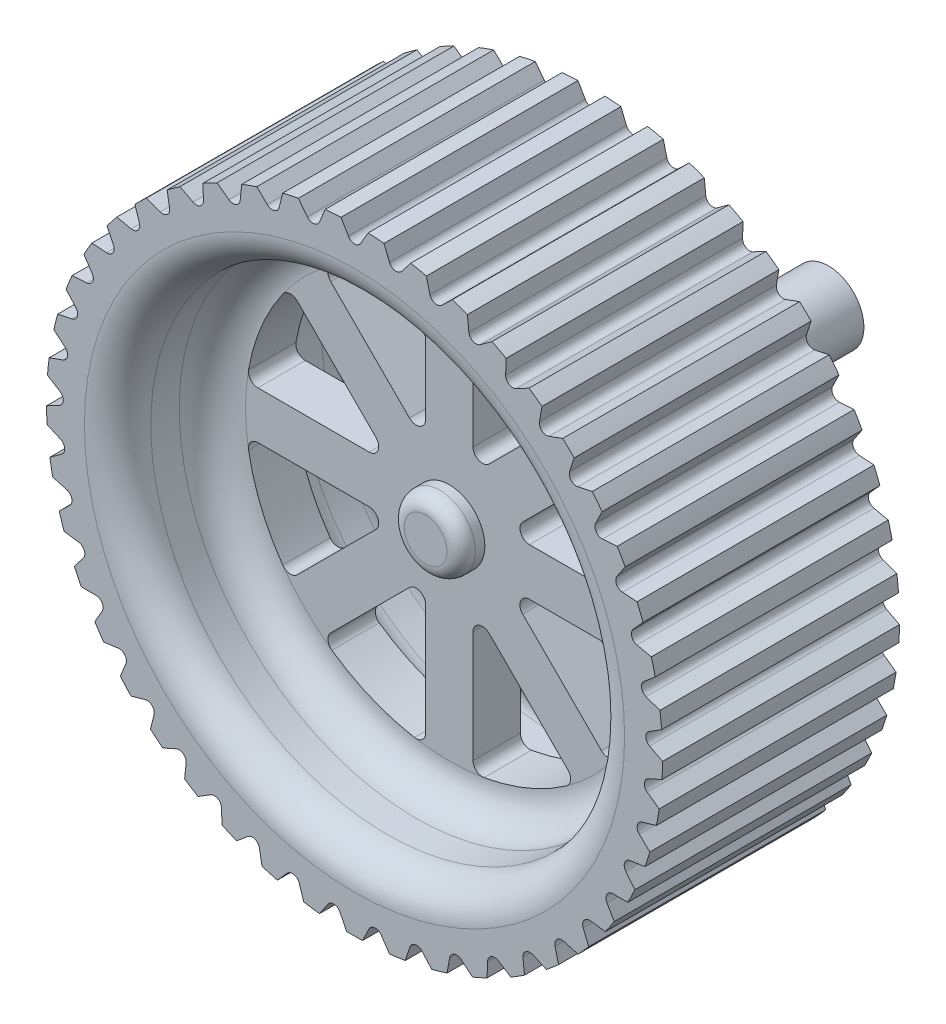
from build123d import *

# Parameters (mm, degrees)
SKETCH1_R                = 7.5
BOSS_EXTRUDE1_DEPTH      = 50
SKETCH2_R                = 65
BOSS_EXTRUDE2_DEPTH      = 50
CUT_EXTRUDE1_REACH       = 137.831
FILLET1_R                = 1.5
CIRPATTERN1_COUNT        = 45
FILLET1_OF_CIRPATTERN1_R = 1.5
SKETCH5_R                = 50
CUT_EXTRUDE2_DEPTH       = 20
CUT_EXTRUDE6_START       = -20
SKETCH6_R                = 50
SKETCH6_R_2              = 7.5
CUT_EXTRUDE6_DEPTH       = 20
FILLET2_R                = 7
BOSS_EXTRUDE3_START      = 5
SKETCH7_R                = 7.5
BOSS_EXTRUDE3_DEPTH      = 5
CUT_EXTRUDE7_REACH       = 123.859
FILLET3_R                = 2
FILLET4_R                = 3


with BuildPart() as part:
    # Sketch1 → Boss-Extrude1 (new body)
    with BuildSketch(Plane.XY):
        Circle(SKETCH1_R)
    extrude(amount=-BOSS_EXTRUDE1_DEPTH)

    # Sketch2 → Boss-Extrude2 (add)
    with BuildSketch(Plane.XY):
        Circle(SKETCH2_R)
    extrude(amount=BOSS_EXTRUDE2_DEPTH)

    # Sketch3 → Cut-Extrude1 (cut, up to next)
    with BuildSketch(Plane.XY.offset(50), mode=Mode.PRIVATE) as cut_extrude1_sk1:
        Polygon((0, 60), (4.330127019, 67.5), (-4.330127019, 67.5), align=None)
    cut_extrude1_tool1 = extrude(cut_extrude1_sk1.sketch, amount=-CUT_EXTRUDE1_REACH, mode=Mode.PRIVATE) & part.part
    cut_extrude1 = cut_extrude1_tool1.solids().sort_by_distance((0, 65, 50))[0]
    add(cut_extrude1, mode=Mode.SUBTRACT)

    # Fillet1
    fillet1_edges = [part.edges().sort_by_distance(p)[0] for p in [
        (0, 60, 25),
    ]]
    fillet(fillet1_edges, radius=FILLET1_R)

    # CirPattern1: Cut-Extrude1 ×45 about axis
    cirpattern1_axis = Axis((0, 0, 0), (0, 0, 1))
    for i in range(1, CIRPATTERN1_COUNT):
        add(cut_extrude1.rotate(cirpattern1_axis, i * 360 / CIRPATTERN1_COUNT), mode=Mode.SUBTRACT)

    # Fillet1 of CirPattern1
    fillet1_of_cirpattern1_edges = [part.edges().sort_by_distance(p)[0] for p in [
        (-8.350386058, 59.416084124, 25),
        (-16.538241349, 57.675701756, 25),
        (-24.404198585, 54.812727459, 25),
        (-31.795155854, 50.882885769, 25),
        (-38.567256581, 45.962666587, 25),
        (-44.588689529, 40.147836382, 25),
        (-49.742254353, 33.551574208, 25),
        (-53.927642778, 26.302268807, 25),
        (-57.063390978, 18.541019662, 25),
        (-59.088465181, 10.41889066, 25),
        (-59.963449621, 2.093969802, 25),
        (-59.671313722, -6.271707796, 25),
        (-58.217743577, -14.515313736, 25),
        (-55.631031274, -22.476395605, 25),
        (-51.961524227, -30, 25),
        (-47.280645216, -36.93968852, 25),
        (-41.679502228, -43.16038802, 25),
        (-35.267115138, -48.541019662, 25),
        (-28.168293767, -52.976855572, 25),
        (-20.5212086, -56.381557247, 25),
        (-12.474701449, -58.688856044, 25),
        (-4.185388425, -59.853843016, 25),
        (4.185388425, -59.853843016, 25),
        (12.474701449, -58.688856044, 25),
        (20.5212086, -56.381557247, 25),
        (28.168293767, -52.976855572, 25),
        (35.267115138, -48.541019662, 25),
        (41.679502228, -43.16038802, 25),
        (47.280645216, -36.93968852, 25),
        (51.961524227, -30, 25),
        (55.631031274, -22.476395605, 25),
        (58.217743577, -14.515313736, 25),
        (59.671313722, -6.271707796, 25),
        (59.963449621, 2.093969802, 25),
        (59.088465181, 10.41889066, 25),
        (57.063390978, 18.541019662, 25),
        (53.927642778, 26.302268807, 25),
        (49.742254353, 33.551574208, 25),
        (44.588689529, 40.147836382, 25),
        (38.567256581, 45.962666587, 25),
        (31.795155854, 50.882885769, 25),
        (24.404198585, 54.812727459, 25),
        (16.538241349, 57.675701756, 25),
        (8.350386058, 59.416084124, 25),
    ]]
    fillet(fillet1_of_cirpattern1_edges, radius=FILLET1_OF_CIRPATTERN1_R)

    # Sketch5 → Cut-Extrude2 (cut)
    with BuildSketch(Plane.XY.offset(50)):
        Circle(SKETCH5_R)
    extrude(amount=-CUT_EXTRUDE2_DEPTH, mode=Mode.SUBTRACT)

    # Sketch6 → Cut-Extrude6 (cut)
    with BuildSketch(Plane(origin=(0, 0, 0), x_dir=(-1, 0, 0), z_dir=(0, 0, -1)).offset(CUT_EXTRUDE6_START)):
        with Locations(Location((0, 0, 0), (0, 0, 180))):
            Circle(SKETCH6_R)
        with Locations(Location((0, 0, 0), (0, 0, 180))):
            Circle(SKETCH6_R_2, mode=Mode.SUBTRACT)
    extrude(amount=CUT_EXTRUDE6_DEPTH, mode=Mode.SUBTRACT)

    # Fillet2
    fillet2_edges = [part.edges().sort_by_distance(p)[0] for p in [
        (-50, 0, 30),
        (-50, 0, 50),
        (-50, 0, 20),
        (-50, 0, 0),
    ]]
    fillet(fillet2_edges, radius=FILLET2_R)

    # Sketch7 → Boss-Extrude3 (add)
    with BuildSketch(Plane.XY.offset(30).offset(BOSS_EXTRUDE3_START)):
        Circle(SKETCH7_R)
    extrude(amount=-BOSS_EXTRUDE3_DEPTH)

    # Sketch8 → Cut-Extrude7 (cut, up to next)
    with BuildSketch(Plane.XY.offset(30), mode=Mode.PRIVATE) as cut_extrude7_sk1:
        with BuildLine():
            Line((-26.663803835, 33.734871647), (-5, 12.071067812))
            Line((-5, 12.071067812), (-5, 42.708313008))
            ThreePointArc((-5, 42.708313008), (-16.455387592, 39.726819898), (-26.663803835, 33.734871647))
        make_face()
    cut_extrude7_tool1 = extrude(cut_extrude7_sk1.sketch, amount=-CUT_EXTRUDE7_REACH, mode=Mode.PRIVATE) & part.part
    # Sketch8 → Cut-Extrude7 (cut, up to next)
    with BuildSketch(Plane.XY.offset(30), mode=Mode.PRIVATE) as cut_extrude7_sk2:
        with BuildLine():
            ThreePointArc((26.663803835, 33.734871647), (16.455387592, 39.726819898), (5, 42.708313008))
            Line((5, 42.708313008), (5, 12.071067812))
            Line((5, 12.071067812), (26.663803835, 33.734871647))
        make_face()
    cut_extrude7_tool2 = extrude(cut_extrude7_sk2.sketch, amount=-CUT_EXTRUDE7_REACH, mode=Mode.PRIVATE) & part.part
    # Sketch8 → Cut-Extrude7 (cut, up to next)
    with BuildSketch(Plane.XY.offset(30), mode=Mode.PRIVATE) as cut_extrude7_sk3:
        with BuildLine():
            Line((33.734871647, 26.663803835), (12.071067812, 5))
            Line((12.071067812, 5), (42.708313008, 5))
            ThreePointArc((42.708313008, 5), (39.726819898, 16.455387592), (33.734871647, 26.663803835))
        make_face()
    cut_extrude7_tool3 = extrude(cut_extrude7_sk3.sketch, amount=-CUT_EXTRUDE7_REACH, mode=Mode.PRIVATE) & part.part
    # Sketch8 → Cut-Extrude7 (cut, up to next)
    with BuildSketch(Plane.XY.offset(30), mode=Mode.PRIVATE) as cut_extrude7_sk4:
        with BuildLine():
            Line((42.708313008, -5), (12.071067812, -5))
            Line((12.071067812, -5), (33.734871647, -26.663803835))
            ThreePointArc((33.734871647, -26.663803835), (39.726819898, -16.455387592), (42.708313008, -5))
        make_face()
    cut_extrude7_tool4 = extrude(cut_extrude7_sk4.sketch, amount=-CUT_EXTRUDE7_REACH, mode=Mode.PRIVATE) & part.part
    # Sketch8 → Cut-Extrude7 (cut, up to next)
    with BuildSketch(Plane.XY.offset(30), mode=Mode.PRIVATE) as cut_extrude7_sk5:
        with BuildLine():
            Line((26.663803835, -33.734871647), (5, -12.071067812))
            Line((5, -12.071067812), (5, -42.708313008))
            ThreePointArc((5, -42.708313008), (16.455387592, -39.726819898), (26.663803835, -33.734871647))
        make_face()
    cut_extrude7_tool5 = extrude(cut_extrude7_sk5.sketch, amount=-CUT_EXTRUDE7_REACH, mode=Mode.PRIVATE) & part.part
    # Sketch8 → Cut-Extrude7 (cut, up to next)
    with BuildSketch(Plane.XY.offset(30), mode=Mode.PRIVATE) as cut_extrude7_sk6:
        with BuildLine():
            Line((-5, -42.708313008), (-5, -12.071067812))
            Line((-5, -12.071067812), (-26.663803835, -33.734871647))
            ThreePointArc((-26.663803835, -33.734871647), (-16.455387592, -39.726819898), (-5, -42.708313008))
        make_face()
    cut_extrude7_tool6 = extrude(cut_extrude7_sk6.sketch, amount=-CUT_EXTRUDE7_REACH, mode=Mode.PRIVATE) & part.part
    # Sketch8 → Cut-Extrude7 (cut, up to next)
    with BuildSketch(Plane.XY.offset(30), mode=Mode.PRIVATE) as cut_extrude7_sk7:
        with BuildLine():
            Line((-33.734871647, -26.663803835), (-12.071067812, -5))
            Line((-12.071067812, -5), (-42.708313008, -5))
            ThreePointArc((-42.708313008, -5), (-39.726819898, -16.455387592), (-33.734871647, -26.663803835))
        make_face()
    cut_extrude7_tool7 = extrude(cut_extrude7_sk7.sketch, amount=-CUT_EXTRUDE7_REACH, mode=Mode.PRIVATE) & part.part
    # Sketch8 → Cut-Extrude7 (cut, up to next)
    with BuildSketch(Plane.XY.offset(30), mode=Mode.PRIVATE) as cut_extrude7_sk8:
        with BuildLine():
            Line((-12.071067812, 5), (-33.734871647, 26.663803835))
            ThreePointArc((-33.734871647, 26.663803835), (-39.726819898, 16.455387592), (-42.708313008, 5))
            Line((-42.708313008, 5), (-12.071067812, 5))
        make_face()
    cut_extrude7_tool8 = extrude(cut_extrude7_sk8.sketch, amount=-CUT_EXTRUDE7_REACH, mode=Mode.PRIVATE) & part.part
    add(cut_extrude7_tool1.solids().sort_by_distance((-12.497411, 30.171419, 30))[0], mode=Mode.SUBTRACT)
    add(cut_extrude7_tool2.solids().sort_by_distance((12.497411, 30.171419, 30))[0], mode=Mode.SUBTRACT)
    add(cut_extrude7_tool3.solids().sort_by_distance((30.171419, 12.497411, 30))[0], mode=Mode.SUBTRACT)
    add(cut_extrude7_tool4.solids().sort_by_distance((30.171419, -12.497411, 30))[0], mode=Mode.SUBTRACT)
    add(cut_extrude7_tool5.solids().sort_by_distance((12.497411, -30.171419, 30))[0], mode=Mode.SUBTRACT)
    add(cut_extrude7_tool6.solids().sort_by_distance((-12.497411, -30.171419, 30))[0], mode=Mode.SUBTRACT)
    add(cut_extrude7_tool7.solids().sort_by_distance((-30.171419, -12.497411, 30))[0], mode=Mode.SUBTRACT)
    add(cut_extrude7_tool8.solids().sort_by_distance((-30.171419, 12.497411, 30))[0], mode=Mode.SUBTRACT)

    # Fillet3
    fillet3_edges = [part.edges().sort_by_distance(p)[0] for p in [
        (-42.708313008, 5, 25),
        (-12.071067812, 5, 25),
        (-33.734871647, 26.663803835, 25),
        (-5, -42.708313008, 25),
        (-5, -12.071067812, 25),
        (-26.663803835, -33.734871647, 25),
        (-33.734871647, -26.663803835, 25),
        (-12.071067812, -5, 25),
        (-42.708313008, -5, 25),
        (42.708313008, -5, 25),
        (12.071067812, -5, 25),
        (33.734871647, -26.663803835, 25),
        (26.663803835, -33.734871647, 25),
        (5, -12.071067812, 25),
        (5, -42.708313008, 25),
        (5, 42.708313008, 25),
        (5, 12.071067812, 25),
        (26.663803835, 33.734871647, 25),
        (33.734871647, 26.663803835, 25),
        (12.071067812, 5, 25),
        (42.708313008, 5, 25),
        (-26.663803835, 33.734871647, 25),
        (-5, 12.071067812, 25),
        (-5, 42.708313008, 25),
    ]]
    fillet(fillet3_edges, radius=FILLET3_R)

    # Fillet4
    fillet4_edges = [part.edges().sort_by_distance(p)[0] for p in [
        (-7.5, 0, 35),
    ]]
    fillet(fillet4_edges, radius=FILLET4_R)


solid = part.part
